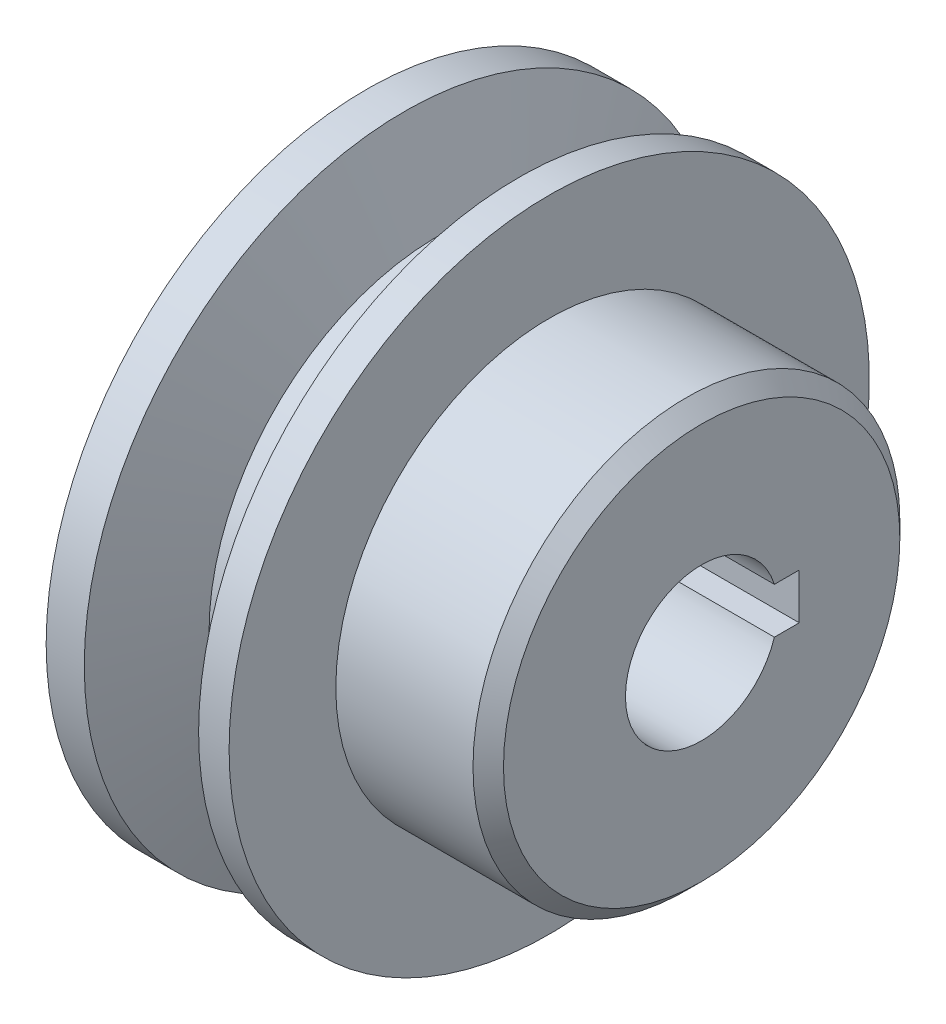
from build123d import *

# Parameters (mm, degrees)
CHAMFER1_SIZE      = 1
CUT_EXTRUDE1_REACH = 38.959


with BuildPart() as part:
    # Sketch1 → Revolve1 (revolve)
    with BuildSketch(Plane.XY, mode=Mode.PRIVATE) as revolve1_sk:
        Polygon((-12, 5), (10, 5), (10, 14), (0, 14), (0, 21), (-2, 21), (-4.183821406, 15), (-7.316178594, 15), (-9.5, 21), (-12, 21), align=None)
    revolve(revolve1_sk.sketch.rotate(Axis((-92.477937902, 0, 0), (1, 0, 0)), 90), axis=Axis((-92.477937902, 0, 0), (1, 0, 0)))

    # Chamfer1
    chamfer1_edges = [part.edges().sort_by_distance(p)[0] for p in [
        (10, 0, -14),
    ]]
    chamfer(chamfer1_edges, length=CHAMFER1_SIZE)

    # Sketch2 → Cut-Extrude1 (cut, up to next)
    with BuildSketch(Plane(origin=(10, 0, 0), x_dir=(0, 0, -1), z_dir=(1, 0, 0)), mode=Mode.PRIVATE) as cut_extrude1_sk1:
        with BuildLine():
            Line((4.769696007, 1.5), (6.4, 1.5))
            Line((6.4, 1.5), (6.4, -1.5))
            Line((6.4, -1.5), (4.769696007, -1.5))
            ThreePointArc((4.769696007, -1.5), (5, 0), (4.769696007, 1.5))
        make_face()
    cut_extrude1_tool1 = extrude(cut_extrude1_sk1.sketch, amount=-CUT_EXTRUDE1_REACH, mode=Mode.PRIVATE) & part.part
    add(cut_extrude1_tool1.solids().sort_by_distance((10, 0, -5.660391))[0], mode=Mode.SUBTRACT)


solid = part.part
